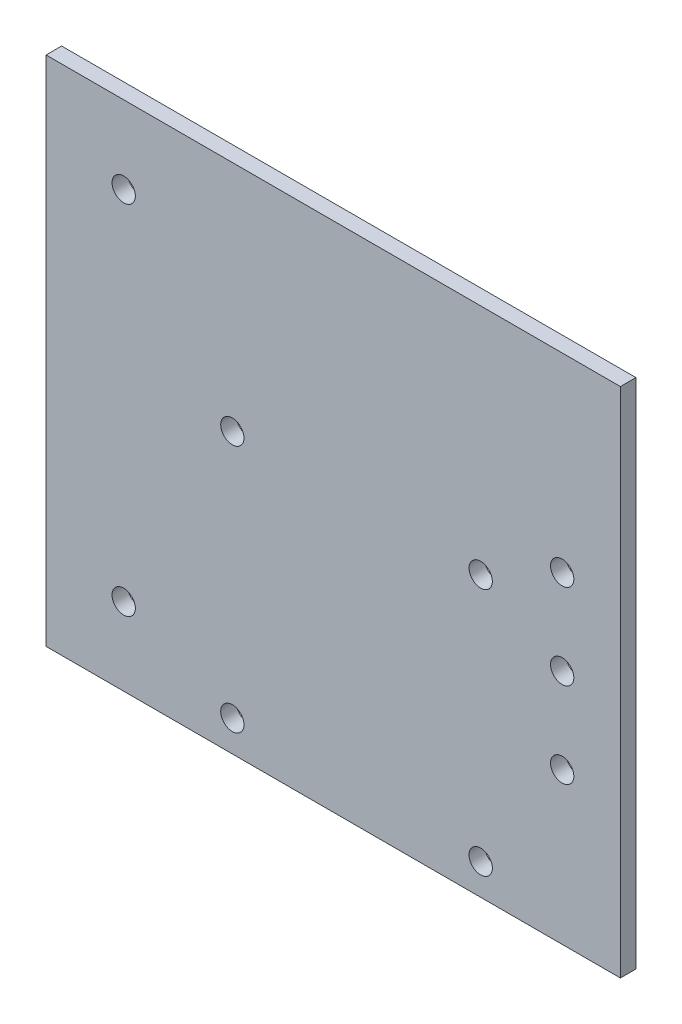
from build123d import *

# Parameters (mm, degrees)
ESQUISSE1_W      = 74
ESQUISSE1_H      = 66
ESQUISSE1_R      = 1.5
EXTRUSION1_DEPTH = 2
ESQUISSE2_R      = 1.5
EXTRUSION2_DEPTH = 10


with BuildPart() as part:
    # Esquisse1 → Extrusion1 (new body)
    with BuildSketch(Plane.XY):
        with Locations((8.831885794, -13.706808511)):
            Rectangle(ESQUISSE1_W, ESQUISSE1_H)
        with Locations((-18.168114206, 9.293191489)):
            Circle(ESQUISSE1_R, mode=Mode.SUBTRACT)
        with Locations((-18.168114206, -36.706808511)):
            Circle(ESQUISSE1_R, mode=Mode.SUBTRACT)
        with Locations((38.331885794, -5.206808511)):
            Circle(ESQUISSE1_R, mode=Mode.SUBTRACT)
        with Locations((38.331885794, -27.206808511)):
            Circle(ESQUISSE1_R, mode=Mode.SUBTRACT)
        with Locations((38.331885794, -16.206808511)):
            Circle(ESQUISSE1_R, mode=Mode.SUBTRACT)
    extrude(amount=EXTRUSION1_DEPTH)

    # Esquisse2 → Extrusion2 (cut)
    with BuildSketch(Plane.XY.offset(2)):
        with Locations((27.831885794, -10.706808511)):
            Circle(ESQUISSE2_R)
        with Locations((-4.168114206, -10.706808511)):
            Circle(ESQUISSE2_R)
        with Locations((-4.168114206, -42.706808511)):
            Circle(ESQUISSE2_R)
        with Locations((27.831885794, -42.706808511)):
            Circle(ESQUISSE2_R)
    extrude(amount=-EXTRUSION2_DEPTH, mode=Mode.SUBTRACT)


solid = part.part
